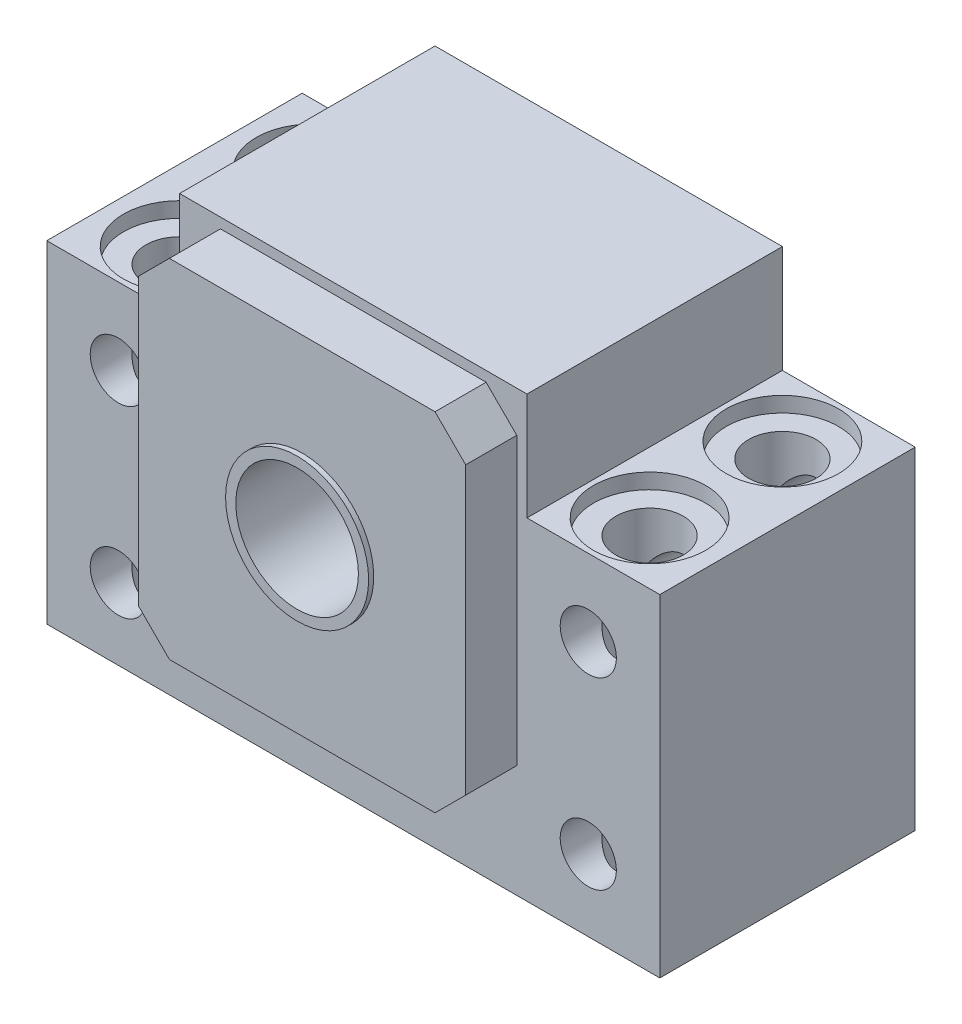
from build123d import *

# Parameters (mm, degrees)
CROQUIS1_R              = 2.75
SALIENTE_EXTRUIR1_DEPTH = 25
CROQUIS2_R              = 6
CORTAR_EXTRUIR1_DEPTH   = 25
CROQUIS5_R              = 3.3
CORTAR_EXTRUIR4_DEPTH   = 73.672209269
CROQUIS6_R              = 5.5
CORTAR_EXTRUIR5_DEPTH   = 1.5
SALIENTE_EXTRUIR2_START = 5
CROQUIS7_W              = 32
CROQUIS7_H              = 34
CROQUIS7_R              = 6
SALIENTE_EXTRUIR2_DEPTH = 5
SALIENTE_EXTRUIR3_START = 0.5
CROQUIS8_R              = 7
CROQUIS8_R_2            = 6
SALIENTE_EXTRUIR3_DEPTH = 0.5
CROQUIS9_R              = 7
CROQUIS9_R_2            = 6
SALIENTE_EXTRUIR4_DEPTH = 0.5
CHAFL_N1_SIZE           = 3


with BuildPart() as part:
    # Croquis1 → Saliente-Extruir1 (new body)
    with BuildSketch(Plane.XY):
        Polygon((0, 0), (60, 0), (60, 32.5), (47, 32.5), (47, 43), (13, 43), (13, 32.5), (0, 32.5), align=None)
        with Locations((7, 25)):
            Circle(CROQUIS1_R, mode=Mode.SUBTRACT)
        with Locations((53, 25)):
            Circle(CROQUIS1_R, mode=Mode.SUBTRACT)
        with Locations((53, 7)):
            Circle(CROQUIS1_R, mode=Mode.SUBTRACT)
        with Locations((7, 7)):
            Circle(CROQUIS1_R, mode=Mode.SUBTRACT)
    extrude(amount=SALIENTE_EXTRUIR1_DEPTH)

    # Croquis2 → Cortar-Extruir1 (cut)
    with BuildSketch(Plane.XY.offset(25)):
        with Locations((30, 25)):
            Circle(CROQUIS2_R)
    extrude(amount=-CORTAR_EXTRUIR1_DEPTH, mode=Mode.SUBTRACT)

    # Croquis5 → Cortar-Extruir4 (cut, through all)
    with BuildSketch(Plane(origin=(0, 32.5, 0), x_dir=(1, 0, 0), z_dir=(0, 1, 0))):
        with Locations(Location((7, -6, 0), (0, 0, 270))):
            Circle(CROQUIS5_R)
        with Locations(Location((53, -6, 0), (0, 0, 270))):
            Circle(CROQUIS5_R)
        with Locations(Location((7, -19, 0), (0, 0, 270))):
            Circle(CROQUIS5_R)
        with Locations(Location((53, -19, 0), (0, 0, 270))):
            Circle(CROQUIS5_R)
    extrude(amount=-CORTAR_EXTRUIR4_DEPTH, mode=Mode.SUBTRACT)

    # Croquis6 → Cortar-Extruir5 (cut)
    with BuildSketch(Plane(origin=(0, 32.5, 0), x_dir=(1, 0, 0), z_dir=(0, 1, 0))):
        with Locations(Location((7, -6, 0), (0, 0, 270))):
            Circle(CROQUIS6_R)
        with Locations(Location((53, -6, 0), (0, 0, 270))):
            Circle(CROQUIS6_R)
        with Locations(Location((7, -19, 0), (0, 0, 270))):
            Circle(CROQUIS6_R)
        with Locations(Location((53, -19, 0), (0, 0, 270))):
            Circle(CROQUIS6_R)
    extrude(amount=-CORTAR_EXTRUIR5_DEPTH, mode=Mode.SUBTRACT)

    # Croquis7 → Saliente-Extruir2 (add)
    with BuildSketch(Plane.XY.offset(25).offset(SALIENTE_EXTRUIR2_START)):
        with Locations((30, 25)):
            Rectangle(CROQUIS7_W, CROQUIS7_H)
        with Locations((30, 25)):
            Circle(CROQUIS7_R, mode=Mode.SUBTRACT)
    extrude(amount=-SALIENTE_EXTRUIR2_DEPTH)

    # Croquis8 → Saliente-Extruir3 (add)
    with BuildSketch(Plane.XY.offset(30).offset(SALIENTE_EXTRUIR3_START)):
        with Locations(Location((30, 25, 0), (0, 0, 180))):
            Circle(CROQUIS8_R)
        with Locations((30, 25)):
            Circle(CROQUIS8_R_2, mode=Mode.SUBTRACT)
    extrude(amount=-SALIENTE_EXTRUIR3_DEPTH)

    # Croquis9 → Saliente-Extruir4 (add)
    with BuildSketch(Plane(origin=(0, 0, 0), x_dir=(-1, 0, 0), z_dir=(0, 0, -1))):
        with Locations((-30, 25)):
            Circle(CROQUIS9_R)
        with Locations(Location((-30, 25, 0), (0, 0, 180))):
            Circle(CROQUIS9_R_2, mode=Mode.SUBTRACT)
    extrude(amount=SALIENTE_EXTRUIR4_DEPTH)

    # Chaflán1
    chafl_n1_edges = [part.edges().sort_by_distance(p)[0] for p in [
        (46, 8, 27.5),
        (46, 42, 27.5),
        (14, 42, 27.5),
        (14, 8, 27.5),
    ]]
    chamfer(chafl_n1_edges, length=CHAFL_N1_SIZE)


solid = part.part
